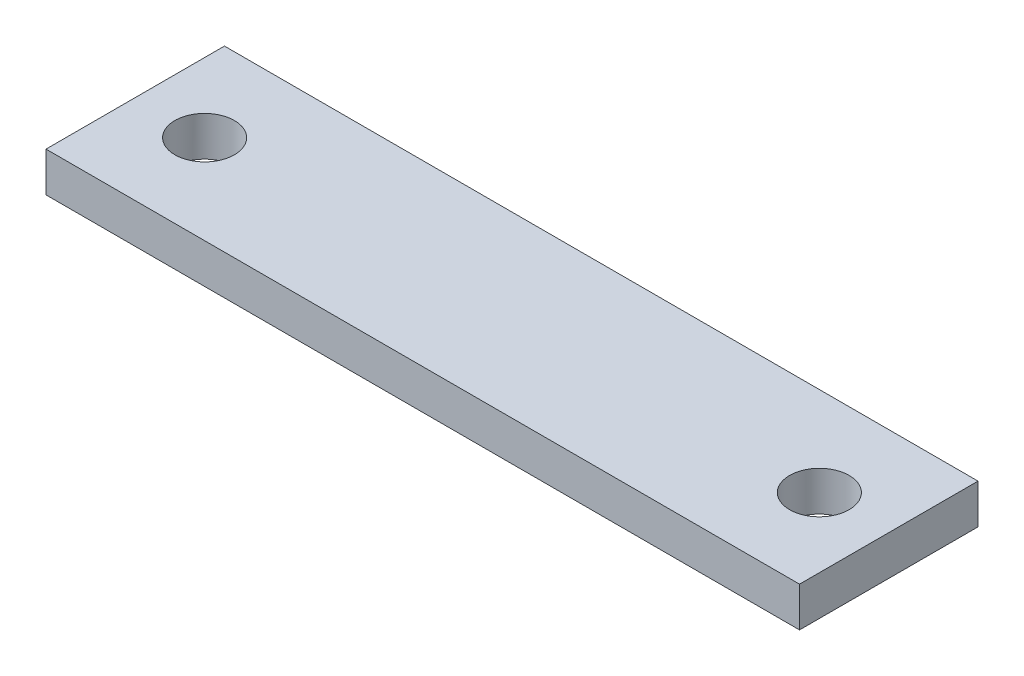
from build123d import *

# Parameters (mm, degrees)
CROQUIS1_W              = 38
CROQUIS1_H              = 9
SALIENTE_EXTRUIR1_DEPTH = 2
CORTAR_EXTRUIR1_REACH   = 21.628
CROQUIS2_R              = 1.5


with BuildPart() as part:
    # Croquis1 → Saliente-Extruir1 (new body)
    with BuildSketch(Plane(origin=(0, 0, 0), x_dir=(1, 0, 0), z_dir=(0, 1, 0))):
        Rectangle(CROQUIS1_W, CROQUIS1_H)
    extrude(amount=SALIENTE_EXTRUIR1_DEPTH)

    # Croquis2 → Cortar-Extruir1 (cut, up to next)
    with BuildSketch(Plane(origin=(0, 2, 0), x_dir=(1, 0, 0), z_dir=(0, 1, 0)), mode=Mode.PRIVATE) as cortar_extruir1_sk1:
        with Locations(Location((-15.5, 0, 0), (0, 0, 270))):
            Circle(CROQUIS2_R)
    cortar_extruir1_tool1 = extrude(cortar_extruir1_sk1.sketch, amount=-CORTAR_EXTRUIR1_REACH, mode=Mode.PRIVATE) & part.part
    # Croquis2 → Cortar-Extruir1 (cut, up to next)
    with BuildSketch(Plane(origin=(0, 2, 0), x_dir=(1, 0, 0), z_dir=(0, 1, 0)), mode=Mode.PRIVATE) as cortar_extruir1_sk2:
        with Locations(Location((15.5, 0, 0), (0, 0, 90))):
            Circle(CROQUIS2_R)
    cortar_extruir1_tool2 = extrude(cortar_extruir1_sk2.sketch, amount=-CORTAR_EXTRUIR1_REACH, mode=Mode.PRIVATE) & part.part
    add(cortar_extruir1_tool1.solids().sort_by_distance((-15.5, 2, 0))[0], mode=Mode.SUBTRACT)
    add(cortar_extruir1_tool2.solids().sort_by_distance((15.5, 2, 0))[0], mode=Mode.SUBTRACT)


solid = part.part
